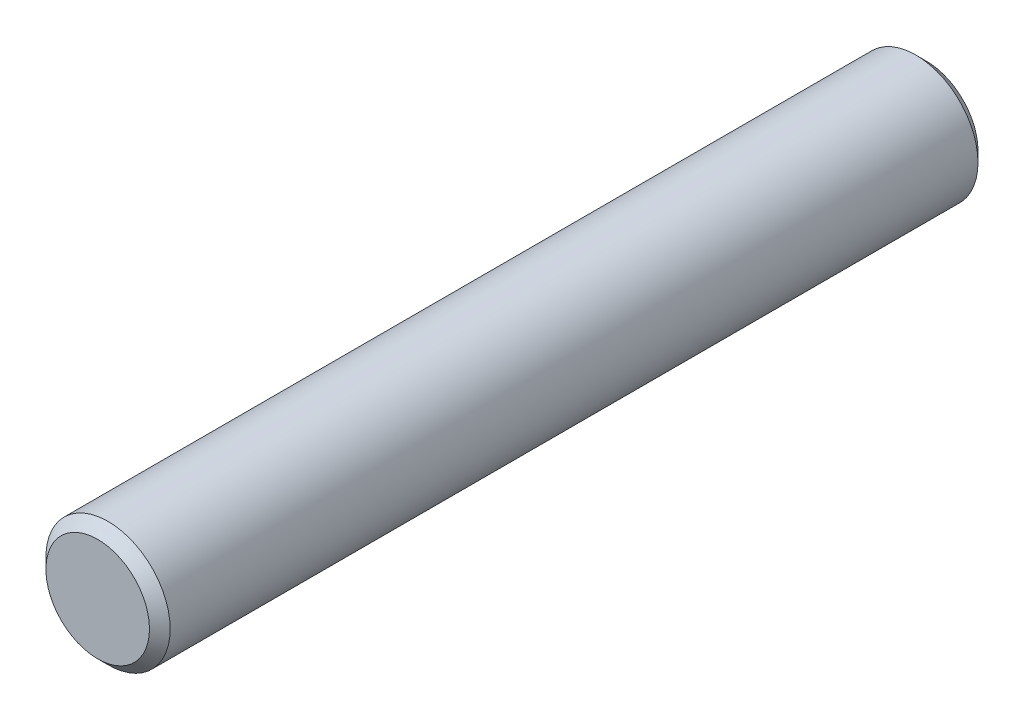
from build123d import *

# Parameters (mm, degrees)
SKETCH1_R           = 3
BOSS_EXTRUDE1_DEPTH = 40
CHAMFER1_SIZE       = 0.5


with BuildPart() as part:
    # Sketch1 → Boss-Extrude1 (new body)
    with BuildSketch(Plane.XY):
        Circle(SKETCH1_R)
    extrude(amount=BOSS_EXTRUDE1_DEPTH)

    # Chamfer1
    chamfer1_edges = [part.edges().sort_by_distance(p)[0] for p in [
        (-3, 0, 0),
        (-3, 0, 40),
    ]]
    chamfer(chamfer1_edges, length=CHAMFER1_SIZE)


solid = part.part
